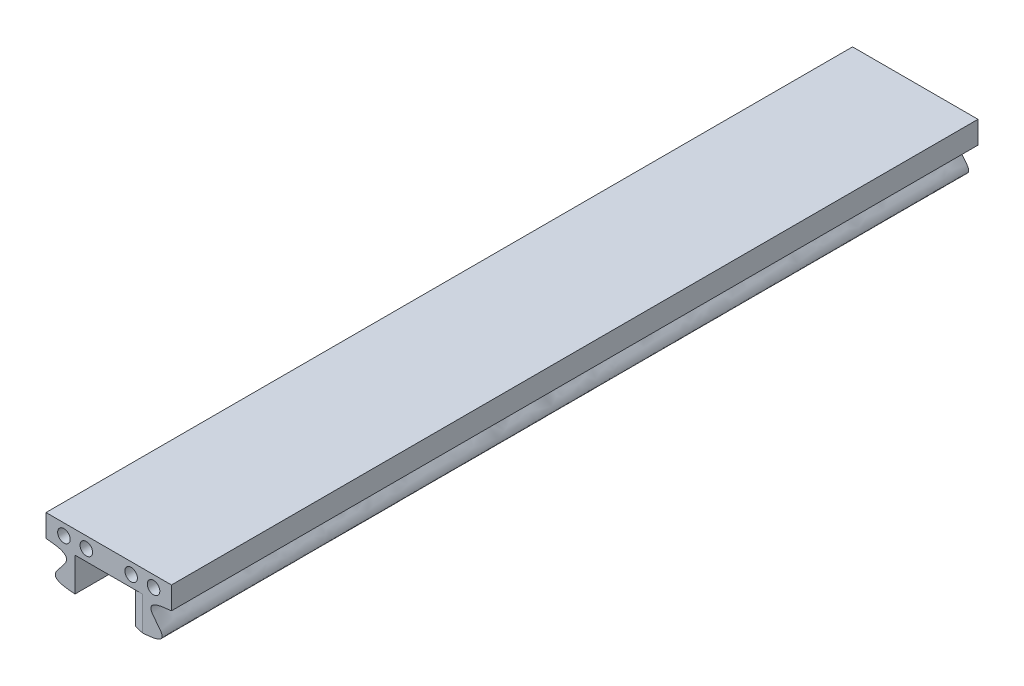
from build123d import *

# Parameters (mm, degrees)
BOSS_EXTRUDE1_DEPTH = 180
BOSS_EXTRUDE2_DEPTH = 7.5
SKETCH4_R           = 1.4
CUT_EXTRUDE1_DEPTH  = 5


with BuildPart() as part:
    # Sketch1 → Boss-Extrude1 (new body)
    with BuildSketch(Plane.XY):
        Polygon((0, 7.5), (6.5, 7.5), (14, 7.5), (21.5, 7.5), (28, 7.5), (28, 12.5), (0, 12.5), align=None)
        with BuildLine():
            Line((6.5, 7.5), (0, 7.5))
            add(Edge.make_bspline(
                [(0, 7.5), (12.375220667, 6.605570649), (-5.595554367, 0.556871246), (6.5, 0)],
                knots=[0, 0, 0, 0, 1, 1, 1, 1], degree=3))
            Line((6.5, 0), (6.5, 7.5))
        make_face()
        with BuildLine():
            add(Edge.make_bspline(
                [(28, 7.5), (15.624779333, 6.605570649), (33.595554367, 0.556871246), (21.5, 0)],
                knots=[0, 0, 0, 0, 1, 1, 1, 1], degree=3))
            Line((21.5, 0), (21.5, 7.5))
            Line((21.5, 7.5), (28, 7.5))
        make_face()
    extrude(amount=BOSS_EXTRUDE1_DEPTH)

    # Sketch3 → Boss-Extrude2 (add)
    with BuildSketch(Plane.XZ.offset(-7.5)):
        Polygon((21.5, 46.35955), (21.5, 48.35156), (19.51, 47.85555), (19.51, 46.85756), align=None)
        Polygon((21.5, 49.35156), (21.5, 51.34357), (19.51, 50.84756), (19.51, 49.84957), align=None)
        Polygon((21.5, 52.34357), (21.5, 54.33558), (19.51, 53.83957), (19.51, 52.84158), align=None)
        Polygon((21.5, 55.33558), (21.5, 57.32759), (19.51, 56.83158), (19.51, 55.83359), align=None)
        Polygon((21.5, 58.32759), (21.5, 60.3196), (19.51, 59.82359), (19.51, 58.8256), align=None)
        Polygon((21.5, 61.3196), (21.5, 63.31161), (19.51, 62.8156), (19.51, 61.81761), align=None)
        Polygon((21.5, 64.31161), (21.5, 66.30362), (19.51, 65.80761), (19.51, 64.80962), align=None)
        Polygon((21.5, 67.30362), (21.5, 69.29563), (19.51, 68.79962), (19.51, 67.80163), align=None)
        Polygon((21.5, 70.29563), (21.5, 72.28764), (19.51, 71.79163), (19.51, 70.79364), align=None)
        Polygon((21.5, 73.28764), (21.5, 75.27965), (19.51, 74.78364), (19.51, 73.78565), align=None)
        Polygon((21.5, 76.27965), (21.5, 78.27166), (19.51, 77.77565), (19.51, 76.77766), align=None)
        Polygon((21.5, 79.27166), (21.5, 81.26367), (19.51, 80.76766), (19.51, 79.76967), align=None)
        Polygon((21.5, 82.26367), (21.5, 84.25568), (19.51, 83.75967), (19.51, 82.76168), align=None)
        Polygon((21.5, 85.25568), (21.5, 87.24769), (19.51, 86.75168), (19.51, 85.75369), align=None)
        Polygon((21.5, 88.24769), (21.5, 90.2397), (19.51, 89.74369), (19.51, 88.7457), align=None)
        Polygon((21.5, 91.2397), (21.5, 93.23171), (19.51, 92.7357), (19.51, 91.73771), align=None)
        Polygon((21.5, 94.23171), (21.5, 96.22372), (19.51, 95.72771), (19.51, 94.72972), align=None)
        Polygon((21.5, 97.22372), (21.5, 99.21573), (19.51, 98.71972), (19.51, 97.72173), align=None)
        Polygon((21.5, 100.21573), (21.5, 102.20774), (19.51, 101.71173), (19.51, 100.71374), align=None)
        Polygon((21.5, 103.20774), (21.5, 105.19975), (19.51, 104.70374), (19.51, 103.70575), align=None)
        Polygon((21.5, 106.19975), (21.5, 108.19176), (19.51, 107.69575), (19.51, 106.69776), align=None)
        Polygon((21.5, 109.19176), (21.5, 111.18377), (19.51, 110.68776), (19.51, 109.68977), align=None)
        Polygon((21.5, 112.18377), (21.5, 114.17578), (19.51, 113.67977), (19.51, 112.68178), align=None)
        Polygon((21.5, 115.17578), (21.5, 117.16779), (19.51, 116.67178), (19.51, 115.67379), align=None)
        Polygon((21.5, 118.16779), (21.5, 120.1598), (19.51, 119.66379), (19.51, 118.6658), align=None)
        Polygon((21.5, 121.1598), (21.5, 123.15181), (19.51, 122.6558), (19.51, 121.65781), align=None)
        Polygon((21.5, 124.15181), (21.5, 126.14382), (19.51, 125.64781), (19.51, 124.64982), align=None)
        Polygon((21.5, 127.14382), (21.5, 129.13583), (19.51, 128.63982), (19.51, 127.64183), align=None)
        Polygon((21.5, 130.13583), (21.5, 132.12784), (19.51, 131.63183), (19.51, 130.63384), align=None)
        Polygon((21.5, 133.12784), (21.5, 135.11985), (19.51, 134.62384), (19.51, 133.62585), align=None)
        Polygon((21.5, 178.00799), (21.5, 180), (19.51, 179.50399), (19.51, 178.506), align=None)
        Polygon((21.5, 136.11985), (21.5, 138.11186), (19.51, 137.61585), (19.51, 136.61786), align=None)
        Polygon((21.5, 139.11186), (21.5, 141.10387), (19.51, 140.60786), (19.51, 139.60987), align=None)
        Polygon((21.5, 142.10387), (21.5, 144.09588), (19.51, 143.59987), (19.51, 142.60188), align=None)
        Polygon((21.5, 145.09588), (21.5, 147.08789), (19.51, 146.59188), (19.51, 145.59389), align=None)
        Polygon((21.5, 148.08789), (21.5, 150.0799), (19.51, 149.58389), (19.51, 148.5859), align=None)
        Polygon((21.5, 151.0799), (21.5, 153.07191), (19.51, 152.5759), (19.51, 151.57791), align=None)
        Polygon((21.5, 154.07191), (21.5, 156.06392), (19.51, 155.56791), (19.51, 154.56992), align=None)
        Polygon((21.5, 157.06392), (21.5, 159.05593), (19.51, 158.55992), (19.51, 157.56193), align=None)
        Polygon((21.5, 175.01598), (21.5, 177.00799), (19.51, 176.51198), (19.51, 175.51399), align=None)
        Polygon((21.5, 172.02397), (21.5, 174.01598), (19.51, 173.51997), (19.51, 172.52198), align=None)
        Polygon((21.5, 169.03196), (21.5, 171.02397), (19.51, 170.52796), (19.51, 169.52997), align=None)
        Polygon((21.5, 166.03995), (21.5, 168.03196), (19.51, 167.53595), (19.51, 166.53796), align=None)
        Polygon((21.5, 163.04794), (21.5, 165.03995), (19.51, 164.54394), (19.51, 163.54595), align=None)
        Polygon((21.5, 160.05593), (21.5, 162.04794), (19.51, 161.55193), (19.51, 160.55394), align=None)
        Polygon((21.5, 43.35955), (21.5, 45.35156), (19.51, 44.85555), (19.51, 43.85756), align=None)
        Polygon((21.5, 1.35955), (21.5, 3.35156), (19.51, 2.85555), (19.51, 1.85756), align=None)
        Polygon((21.5, 4.35955), (21.5, 6.35156), (19.51, 5.85555), (19.51, 4.85756), align=None)
        Polygon((21.5, 7.35955), (21.5, 9.35156), (19.51, 8.85555), (19.51, 7.85756), align=None)
        Polygon((21.5, 10.35955), (21.5, 12.35156), (19.51, 11.85555), (19.51, 10.85756), align=None)
        Polygon((21.5, 13.35955), (21.5, 15.35156), (19.51, 14.85555), (19.51, 13.85756), align=None)
        Polygon((21.5, 16.35955), (21.5, 18.35156), (19.51, 17.85555), (19.51, 16.85756), align=None)
        Polygon((21.5, 19.35955), (21.5, 21.35156), (19.51, 20.85555), (19.51, 19.85756), align=None)
        Polygon((21.5, 22.35955), (21.5, 24.35156), (19.51, 23.85555), (19.51, 22.85756), align=None)
        Polygon((21.5, 25.35955), (21.5, 27.35156), (19.51, 26.85555), (19.51, 25.85756), align=None)
        Polygon((21.5, 28.35955), (21.5, 30.35156), (19.51, 29.85555), (19.51, 28.85756), align=None)
        Polygon((21.5, 31.35955), (21.5, 33.35156), (19.51, 32.85555), (19.51, 31.85756), align=None)
        Polygon((21.5, 34.35955), (21.5, 36.35156), (19.51, 35.85555), (19.51, 34.85756), align=None)
        Polygon((21.5, 37.35955), (21.5, 39.35156), (19.51, 38.85555), (19.51, 37.85756), align=None)
        Polygon((21.5, 40.35955), (21.5, 42.35156), (19.51, 41.85555), (19.51, 40.85756), align=None)
    extrude(amount=BOSS_EXTRUDE2_DEPTH)

    # Sketch4 → Cut-Extrude1 (cut)
    with BuildSketch(Plane.XY.offset(180)):
        with Locations((24, 10)):
            Circle(SKETCH4_R)
        with Locations((19, 10)):
            Circle(SKETCH4_R)
        with Locations((9, 10)):
            Circle(SKETCH4_R)
        with Locations((4, 10)):
            Circle(SKETCH4_R)
    extrude(amount=-CUT_EXTRUDE1_DEPTH, mode=Mode.SUBTRACT)


solid = part.part
